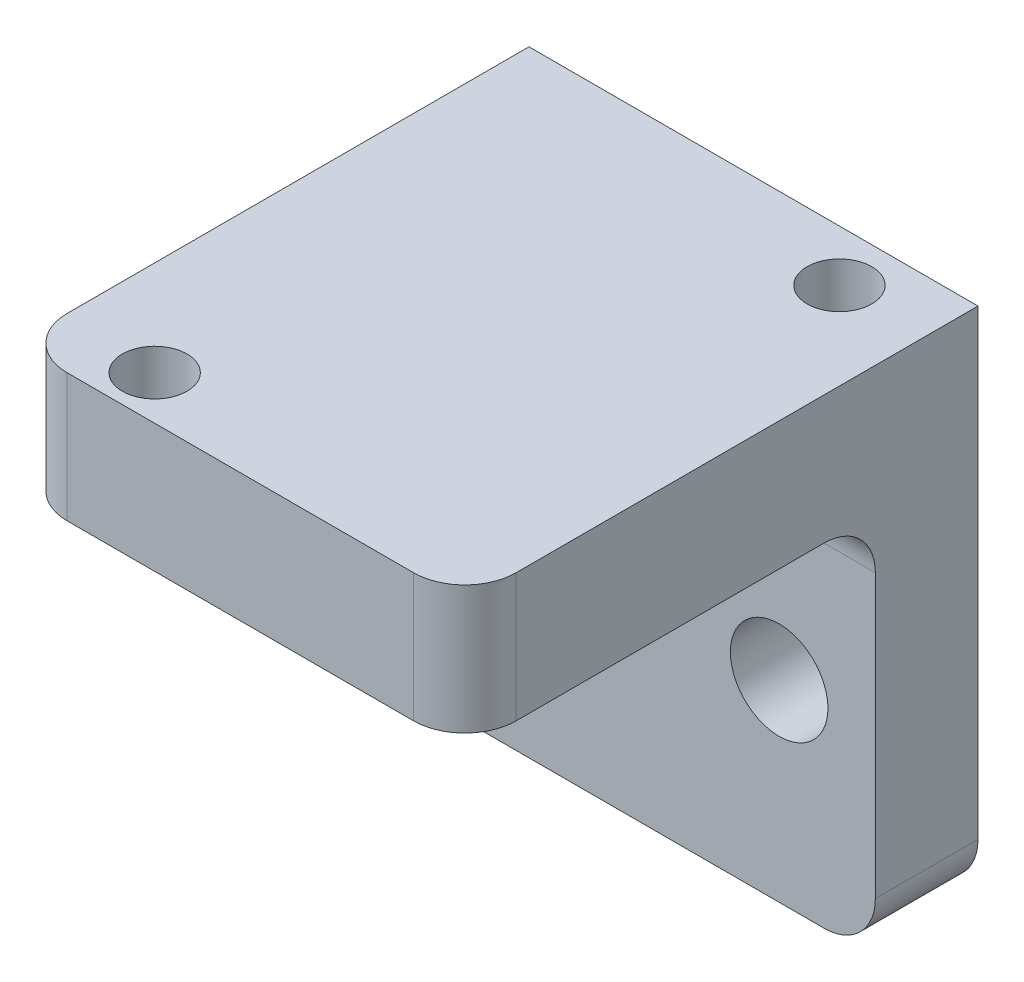
from build123d import *

# Parameters (mm, degrees)
SKETCH1_W           = 22.225
SKETCH1_H           = 25.4
SKETCH1_R           = 1.6002
BOSS_EXTRUDE1_DEPTH = 6.35
SKETCH2_W           = 22.225
SKETCH2_H           = 19.05
SKETCH2_R           = 2.413
BOSS_EXTRUDE2_DEPTH = 5.08
FILLET1_R           = 2.54


with BuildPart() as part:
    # Sketch1 → Boss-Extrude1 (new body)
    with BuildSketch(Plane(origin=(0, 0, 0), x_dir=(1, 0, 0), z_dir=(0, 1, 0))):
        with Locations((3.3655, 0)):
            Rectangle(SKETCH1_W, SKETCH1_H)
        with Locations(Location((10.16, 10.16, 0), (0, 0, 270))):
            Circle(SKETCH1_R, mode=Mode.SUBTRACT)
        with Locations(Location((-3.044225571, -10.529380079, 0), (0, 0, 270))):
            Circle(SKETCH1_R, mode=Mode.SUBTRACT)
    extrude(amount=-BOSS_EXTRUDE1_DEPTH)

    # Sketch2 → Boss-Extrude2 (add)
    with BuildSketch(Plane(origin=(0, 0, -12.7), x_dir=(-1, 0, 0), z_dir=(0, 0, -1))):
        with Locations((-3.3655, -15.875)):
            Rectangle(SKETCH2_W, SKETCH2_H)
        with Locations((-9.7155, -15.875)):
            Circle(SKETCH2_R, mode=Mode.SUBTRACT)
        with Locations((2.9845, -15.875)):
            Circle(SKETCH2_R, mode=Mode.SUBTRACT)
    extrude(amount=-BOSS_EXTRUDE2_DEPTH)

    # Fillet1
    fillet1_edges = [part.edges().sort_by_distance(p)[0] for p in [
        (3.3655, -6.35, -7.62),
        (14.478, -25.4, -10.16),
        (-7.747, -25.4, -10.16),
        (14.478, -3.175, 12.7),
        (-7.747, -3.175, 12.7),
    ]]
    fillet(fillet1_edges, radius=FILLET1_R)


solid = part.part
